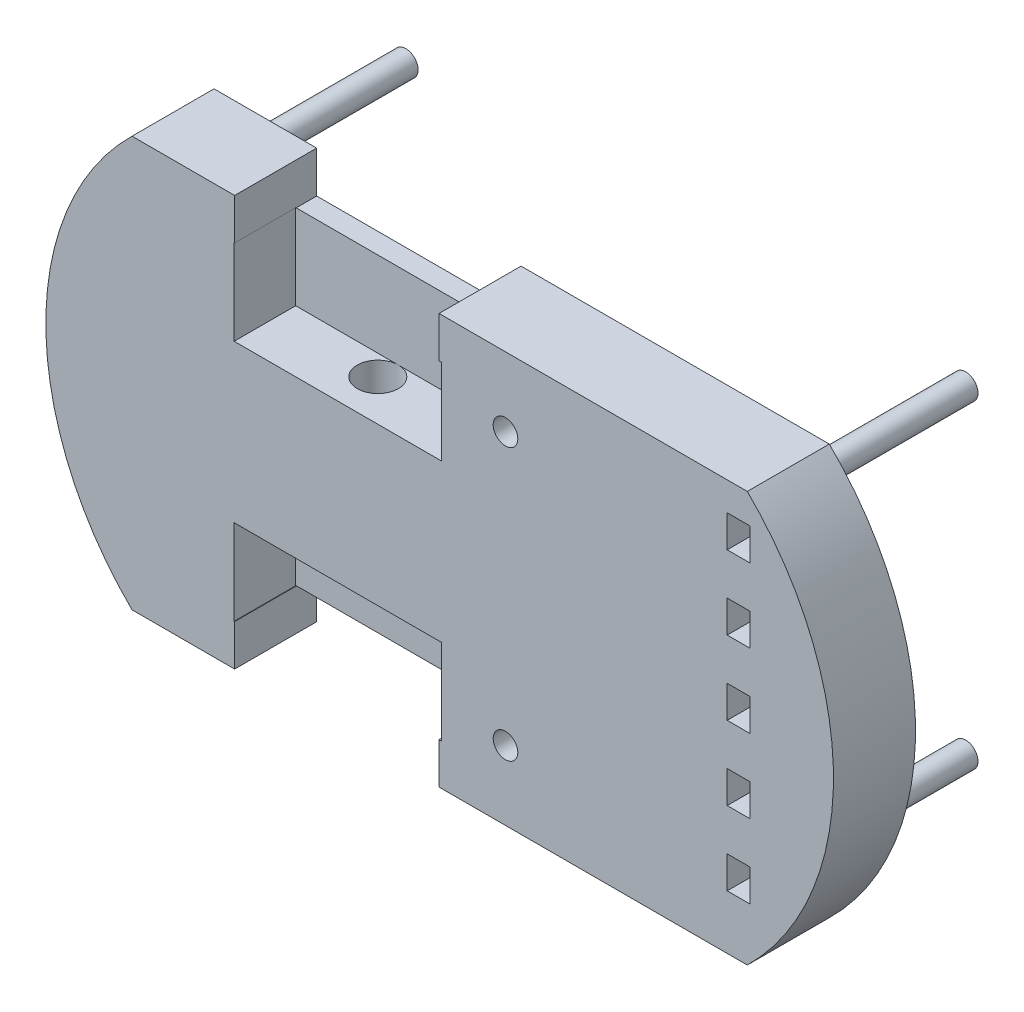
from build123d import *

# Parameters (mm, degrees)
SKETCH1_W               = 15
SKETCH1_H               = 10
BOSS_EXTRUDE1_DEPTH     = 2
CUT_EXTRUDE1_DEPTH      = 66.450316178
CUT_EXTRUDE1_DEPTH_BACK = 66.450316178
SKETCH2_W               = 4.982815842
SKETCH2_H               = 1.189314069
SKETCH2_H_2             = 1.18931407
CUT_EXTRUDE2_DEPTH      = 66.450316178
CUT_EXTRUDE2_DEPTH_BACK = 66.450316178
SKETCH3_R               = 0.3
SKETCH4_R               = 0.3
BOSS_EXTRUDE2_DEPTH     = 4
CUT_EXTRUDE3_DEPTH      = 45.209586789
CUT_EXTRUDE3_DEPTH_BACK = 45.209586789
SKETCH5_R               = 0.5
BOSS_EXTRUDE4_DEPTH     = 1
FILLET4_R               = 0.1
CUT_EXTRUDE4_DEPTH      = 0.4
SKETCH9_W               = 5.055486227
SKETCH9_H               = 2.081670799
SKETCH9_H_2             = 2.0816708
CUT_EXTRUDE5_DEPTH      = 1.5
SKETCH10_W              = 0.553722479
SKETCH10_H              = 0.781725852
CUT_EXTRUDE7_DEPTH      = 1


with BuildPart() as part:
    # Sketch1 → Boss-Extrude1 (new body)
    with BuildSketch(Plane.XY):
        with BuildLine():
            Line((-41, 49.214285714), (-41, 39.214285714))
            ThreePointArc((-41, 39.214285714), (-43.101020514, 44.214285714), (-41, 49.214285714))
        make_face()
        with Locations((-33.5, 44.214285714)):
            Rectangle(SKETCH1_W, SKETCH1_H)
        with BuildLine():
            ThreePointArc((-26, 49.214285714), (-23.898979486, 44.214285714), (-26, 39.214285714))
            Line((-26, 39.214285714), (-26, 49.214285714))
        make_face()
    extrude(amount=BOSS_EXTRUDE1_DEPTH)

    # Sketch2 → Cut-Extrude1 (cut, two sides: drawn at the far end of the back side and taken through both)
    with BuildSketch(Plane.XY.offset(2).offset(-CUT_EXTRUDE1_DEPTH_BACK)):
        with Locations((-36.006215856, 39.631325465)):
            Rectangle(SKETCH2_W, SKETCH2_H)
        with Locations((-36.006215856, 48.797245964)):
            Rectangle(SKETCH2_W, SKETCH2_H_2)
    extrude(amount=CUT_EXTRUDE1_DEPTH + CUT_EXTRUDE1_DEPTH_BACK, mode=Mode.SUBTRACT)

    # Sketch3 → Cut-Extrude2 (cut, two sides: drawn at the far end of the back side and taken through both)
    with BuildSketch(Plane.XY.offset(2).offset(-CUT_EXTRUDE2_DEPTH_BACK)):
        with Locations((-31.894880151, 47.525910235)):
            Circle(SKETCH3_R)
        with Locations(Location((-31.894880151, 40.902661194, 0), (0, 0, 180))):
            Circle(SKETCH3_R)
    extrude(amount=CUT_EXTRUDE2_DEPTH + CUT_EXTRUDE2_DEPTH_BACK, mode=Mode.SUBTRACT)

    # Sketch4 → Boss-Extrude2 (add)
    with BuildSketch(Plane(origin=(0, 0, 0), x_dir=(-1, 0, 0), z_dir=(0, 0, -1))):
        with Locations(Location((26.675429713, 48.101362416, 0), (0, 0, 180))):
            Circle(SKETCH4_R)
        with Locations(Location((26.675429713, 40.327209012, 0), (0, 0, 180))):
            Circle(SKETCH4_R)
        with Locations(Location((40.324570287, 40.327209012, 0), (0, 0, 180))):
            Circle(SKETCH4_R)
        with Locations(Location((40.324570287, 48.101362416, 0), (0, 0, 180))):
            Circle(SKETCH4_R)
    extrude(amount=BOSS_EXTRUDE2_DEPTH)

    # Sketch5 → Cut-Extrude3 (cut, two sides: drawn at the far end of the back side and taken through both)
    with BuildSketch(Plane.XZ.offset(-40.225982499).offset(-CUT_EXTRUDE3_DEPTH_BACK)):
        with Locations(Location((-36.007623777, 1, 0), (0, 0, 270))):
            Circle(SKETCH5_R)
    extrude(amount=CUT_EXTRUDE3_DEPTH + CUT_EXTRUDE3_DEPTH_BACK, mode=Mode.SUBTRACT)

    # Sketch6 → Boss-Extrude4 (add)
    with BuildSketch(Plane(origin=(0, 0, 0), x_dir=(-1, 0, 0), z_dir=(0, 0, -1))):
        Polygon((27.771990414, 41.042860475), (27.771990414, 47.255234787), (30.48768547, 47.255234787), (30.48768547, 47.663476527), (27.434747237, 47.663476527), (27.434747237, 40.643391403), (30.48768547, 40.643391403), (30.48768547, 41.042860475), align=None)
    extrude(amount=BOSS_EXTRUDE4_DEPTH)

    # Fillet4
    fillet4_edges = [part.edges().sort_by_distance(p)[0] for p in [
        (-30.48768547, 47.459355657, -1),
        (-28.961216354, 47.663476527, -1),
        (-30.48768547, 40.843125939, -1),
        (-29.129837942, 41.042860475, -1),
        (-27.771990414, 44.149047631, -1),
        (-27.434747237, 44.153433965, -1),
        (-28.961216354, 40.643391403, -1),
        (-29.129837942, 47.255234787, -1),
    ]]
    fillet(fillet4_edges, radius=FILLET4_R)

    # Sketch8 → Cut-Extrude4 (cut)
    with BuildSketch(Plane(origin=(0, 0, 0), x_dir=(-1, 0, 0), z_dir=(0, 0, -1))):
        with BuildLine():
            Line((40.791436274, 48.714285714), (38.997623777, 48.714285714))
            Line((38.997623777, 48.714285714), (38.997623777, 47.702588929))
            Line((38.997623777, 47.702588929), (33.014807935, 47.702588929))
            Line((33.014807935, 47.702588929), (33.014807935, 48.714285714))
            Line((33.014807935, 48.714285714), (26.208563726, 48.714285714))
            ThreePointArc((26.208563726, 48.714285714), (24.398979486, 44.214285714), (26.208563726, 39.714285714))
            Line((26.208563726, 39.714285714), (33.014807935, 39.714285714))
            Line((33.014807935, 39.714285714), (33.014807935, 40.725982499))
            Line((33.014807935, 40.725982499), (38.997623777, 40.725982499))
            Line((38.997623777, 40.725982499), (38.997623777, 39.714285714))
            Line((38.997623777, 39.714285714), (40.791436274, 39.714285714))
            ThreePointArc((40.791436274, 39.714285714), (42.601020514, 44.214285714), (40.791436274, 48.714285714))
        make_face()
    extrude(amount=-CUT_EXTRUDE4_DEPTH, mode=Mode.SUBTRACT)


with BuildPart() as cut_extrude4_piece_1:
    # of the separate pieces the step leaves, piece 1, a body of its own (cut_extrude4_pieces)
    add(part.part.solids().sort_by_distance((-41, 39.214285714, 0))[0])

    # Sketch9 → Cut-Extrude5 (cut)
    with BuildSketch(Plane.XY.offset(2)):
        with Locations((-35.982073043, 47.170126627)):
            Rectangle(SKETCH9_W, SKETCH9_H)
        with Locations((-35.982073043, 41.258444801)):
            Rectangle(SKETCH9_W, SKETCH9_H_2)
    extrude(amount=-CUT_EXTRUDE5_DEPTH, mode=Mode.SUBTRACT)

    # Sketch10 → Cut-Extrude7 (cut)
    with BuildSketch(Plane.XY.offset(2)):
        with Locations((-26.213222197, 46.3271403)):
            Rectangle(SKETCH10_W, SKETCH10_H)
        with Locations((-26.213222197, 48.1271403)):
            Rectangle(SKETCH10_W, SKETCH10_H)
        with Locations((-26.213222197, 44.5271403)):
            Rectangle(SKETCH10_W, SKETCH10_H)
        with Locations((-26.213222197, 42.7271403)):
            Rectangle(SKETCH10_W, SKETCH10_H)
        with Locations((-26.213222197, 40.9271403)):
            Rectangle(SKETCH10_W, SKETCH10_H)
    extrude(amount=-CUT_EXTRUDE7_DEPTH, mode=Mode.SUBTRACT)


with BuildPart() as cut_extrude4_piece_2:
    # of the separate pieces the step leaves, piece 2, a body of its own (cut_extrude4_pieces)
    add(part.part.solids().sort_by_distance((-27.771990414, 41.042860475, -0.9))[0])


with BuildPart() as cut_extrude4_piece_3:
    # of the separate pieces the step leaves, piece 3, a body of its own (cut_extrude4_pieces)
    add(part.part.solids().sort_by_distance((-40.024570287, 40.327209012, 0))[0])


with BuildPart() as cut_extrude4_piece_4:
    # of the separate pieces the step leaves, piece 4, a body of its own (cut_extrude4_pieces)
    add(part.part.solids().sort_by_distance((-40.024570287, 48.101362416, 0))[0])


with BuildPart() as cut_extrude4_piece_5:
    # of the separate pieces the step leaves, piece 5, a body of its own (cut_extrude4_pieces)
    add(part.part.solids().sort_by_distance((-26.375429713, 40.327209012, 0))[0])


with BuildPart() as cut_extrude4_piece_6:
    # of the separate pieces the step leaves, piece 6, a body of its own (cut_extrude4_pieces)
    add(part.part.solids().sort_by_distance((-26.375429713, 48.101362416, 0))[0])


solid = Compound([cut_extrude4_piece_1.part, cut_extrude4_piece_2.part, cut_extrude4_piece_3.part, cut_extrude4_piece_4.part, cut_extrude4_piece_5.part, cut_extrude4_piece_6.part])
